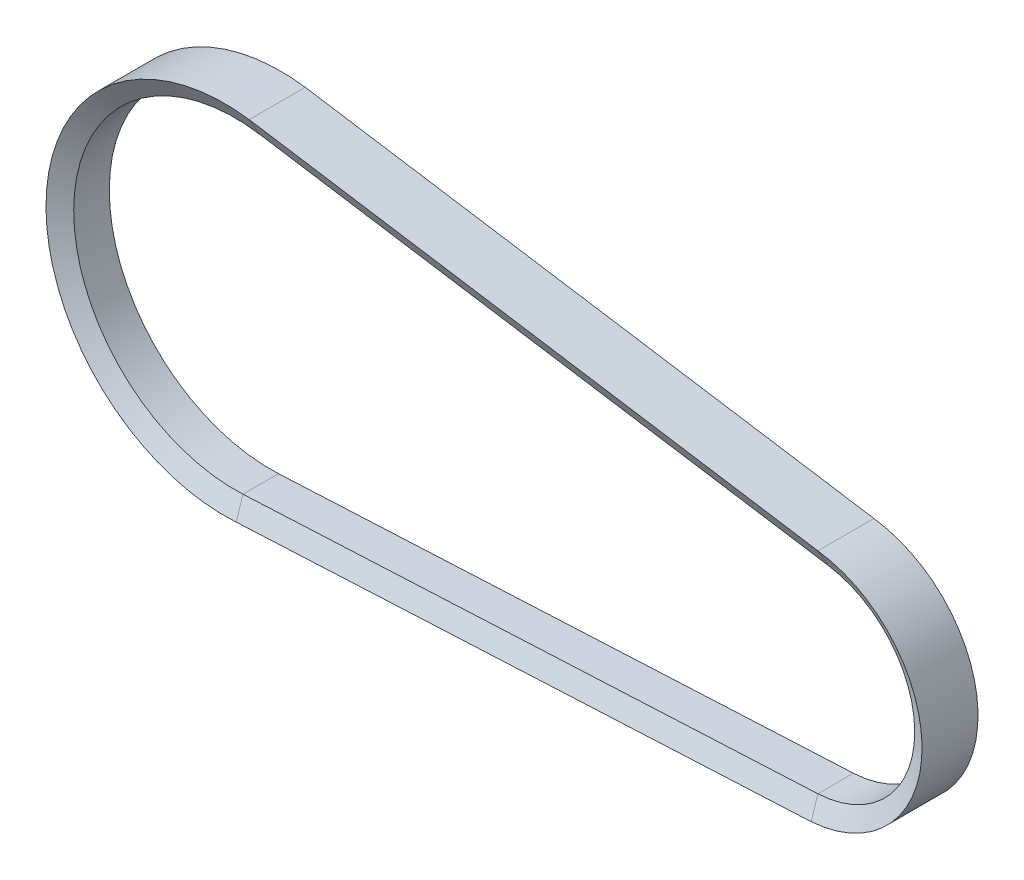
from build123d import *


with BuildPart() as part:
    # Sweep1: sweep along a path in Sketch2
    with BuildLine(Plane.XY) as sweep1_path:
        Line((8.35924728, 53.349067329), (201.258206604, 23.123794764))
        ThreePointArc((201.258206604, 23.123794764), (229.946601651, -12.279414823), (197.650968978, -44.426006706))
        Line((197.650968978, -44.426006706), (2.630105168, -53.935911477))
        ThreePointArc((2.630105168, -53.935911477), (-53.923168825, 2.879559662), (8.35924728, 53.349067329))
    # Sketch3 → Sweep1 (sweep)
    with BuildSketch(Plane(origin=(8.35924728, 0, 0), x_dir=(0, 0, -1), z_dir=(1, 0, 0))):
        Polygon((-6.035, 54), (6.035, 54), (9.499101615, 60), (-9.499101615, 60), align=None)
    sweep(path=sweep1_path.line)


solid = part.part
